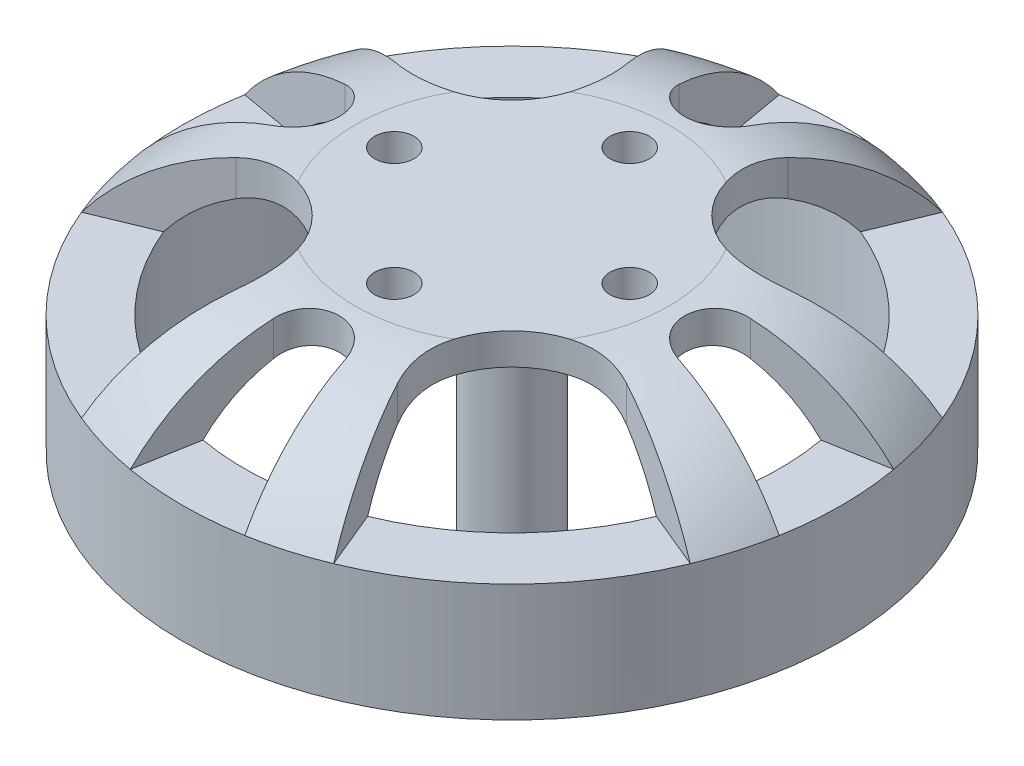
from build123d import *

# Parameters (mm, degrees)
M3X0_5_TAPPED_HOLE1_D = 2.5
CUT_EXTRUDE1_START    = -5.5
CUT_EXTRUDE1_DEPTH    = 5.5
CIRPATTERN1_COUNT     = 4


with BuildPart() as part:
    # Sketch2 → Revolve2 (revolve)
    with BuildSketch(Plane.XY, mode=Mode.PRIVATE) as revolve2_sk:
        with BuildLine():
            Line((0, 0), (0, 19))
            Line((0, 19), (-10, 19))
            ThreePointArc((-10, 19), (-16.149186938, 17.548373876), (-21, 13.5))
            Line((-21, 13.5), (-21, 6))
            Line((-21, 6), (-17, 6))
            Line((-17, 6), (-17, 13.5))
            ThreePointArc((-17, 13.5), (-13.913118961, 16.076237921), (-10, 17))
            Line((-10, 17), (-2.5, 17))
            Line((-2.5, 17), (-2.5, 0))
            Line((-2.5, 0), (0, 0))
        make_face()
    revolve(revolve2_sk.sketch.rotate(Axis((0, 0, 0), (0, 1, 0)), 270), axis=Axis((0, 0, 0), (0, 1, 0)))

    # M3x0.5 Tapped Hole1 (through all)
    with Locations(Plane(origin=(0, 19, 0), x_dir=(1, 0, 0), z_dir=(0, 1, 0))):
        with Locations((7.5, 0), (0, 7.5), (-7.5, 0), (0, -7.5)):
            Hole(M3X0_5_TAPPED_HOLE1_D / 2)

    # Sketch6 → Cut-Extrude1 (cut)
    with BuildSketch(Plane(origin=(0, 19, 0), x_dir=(1, 0, 0), z_dir=(0, 1, 0)).offset(CUT_EXTRUDE1_START)):
        with BuildLine():
            Line((12.910129954, 2.276404235), (20.680962813, 3.646611731))
            ThreePointArc((20.680962813, 3.646611731), (21, 0), (20.680962813, -3.646611731))
            Line((20.680962813, -3.646611731), (12.910129954, -2.276404235))
            ThreePointArc((12.910129954, -2.276404235), (11, 0), (12.910129954, 2.276404235))
        make_face()
        with BuildLine():
            Line((8.03635208, 19.401470183), (5.154536071, 12.444150891))
            ThreePointArc((5.154536071, 12.444150891), (6.363961031, 6.363961031), (12.444150891, 5.154536071))
            Line((12.444150891, 5.154536071), (19.401470183, 8.03635208))
            ThreePointArc((19.401470183, 8.03635208), (14.849242405, 14.849242405), (8.03635208, 19.401470183))
        make_face()
    cut_extrude1 = extrude(amount=CUT_EXTRUDE1_DEPTH, mode=Mode.SUBTRACT)

    # CirPattern1: Cut-Extrude1 ×4 about axis
    cirpattern1_axis = Axis((0, 0, 0), (0, 1, 0))
    for i in range(1, CIRPATTERN1_COUNT):
        add(cut_extrude1.rotate(cirpattern1_axis, i * 360 / CIRPATTERN1_COUNT), mode=Mode.SUBTRACT)


solid = part.part
